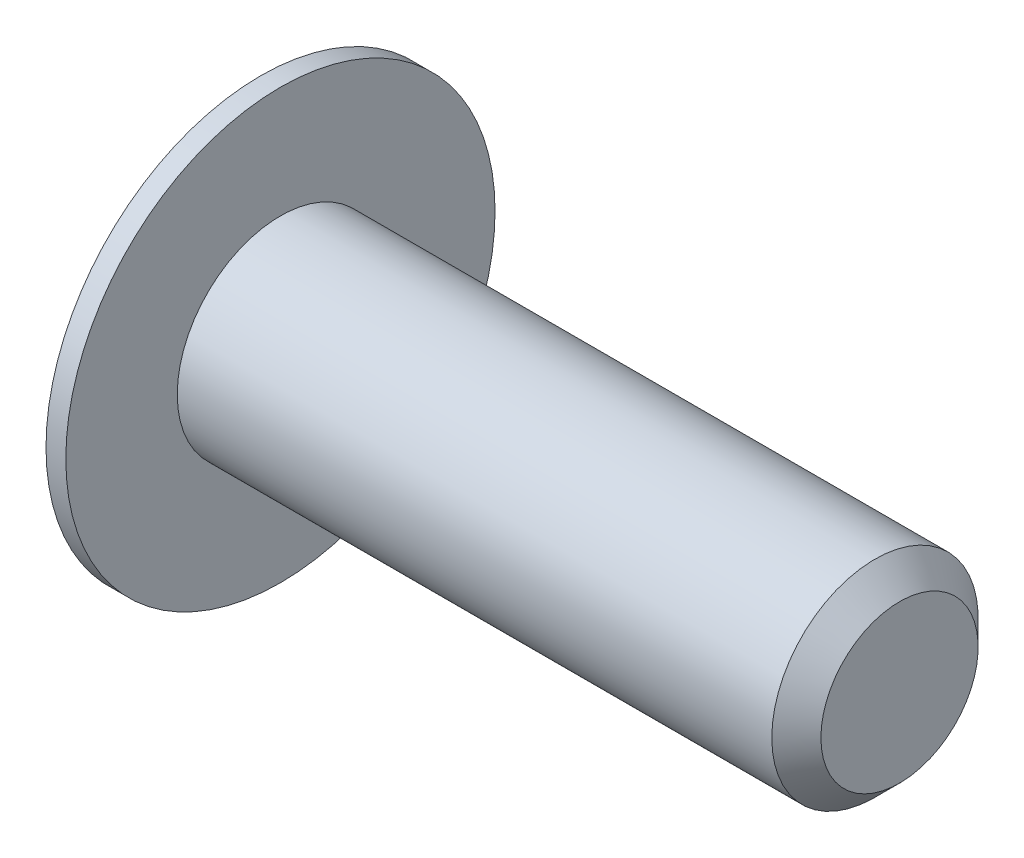
from build123d import *

# Parameters (mm, degrees)
SKETCH2_R           = 3.175
BOSS_EXTRUDE1_DEPTH = 19.05
CUT_EXTRUDE1_DEPTH  = 2.286
CHAMFER1_SIZE       = 0.75565


with BuildPart() as part:
    # Sketch1 → Revolve1 (revolve)
    with BuildSketch(Plane(origin=(0, 0, 0), x_dir=(-1, 0, 0), z_dir=(0, 0, -1)), mode=Mode.PRIVATE) as revolve1_sk:
        with BuildLine():
            Line((0, 6.604), (0, 0))
            Line((0, 0), (3.048, 0))
            Line((3.048, 0), (3.048, 2.4384))
            add(Edge.make_bspline(
                [(0.6096, 5.9436), (1.756478304, 5.100704659), (2.65656918, 3.806824025), (3.048, 2.4384)],
                knots=[0, 0, 0, 0, 1, 1, 1, 1], degree=3))
            Line((0.6096, 5.9436), (0.6096, 6.604))
            Line((0.6096, 6.604), (0, 6.604))
        make_face()
    revolve(revolve1_sk.sketch.rotate(Axis((0, 0, 0), (-1, 0, 0)), 270), axis=Axis((0, 0, 0), (-1, 0, 0)))

    # Sketch2 → Boss-Extrude1 (add)
    with BuildSketch(Plane(origin=(0, 0, 0), x_dir=(0, 0, -1), z_dir=(1, 0, 0))):
        Circle(SKETCH2_R)
    extrude(amount=BOSS_EXTRUDE1_DEPTH)

    # Sketch3 → Cut-Extrude1 (cut)
    with BuildSketch(Plane.ZY.offset(3.048)):
        Polygon((0, -2.346351494), (2.032, -1.173175747), (2.032, 1.173175747), (0, 2.346351494), (-2.032, 1.173175747), (-2.032, -1.173175747), align=None)
    extrude(amount=-CUT_EXTRUDE1_DEPTH, mode=Mode.SUBTRACT)

    # Chamfer1
    chamfer1_edges = [part.edges().sort_by_distance(p)[0] for p in [
        (19.05, 0, 3.175),
    ]]
    chamfer(chamfer1_edges, length=CHAMFER1_SIZE)


solid = part.part
